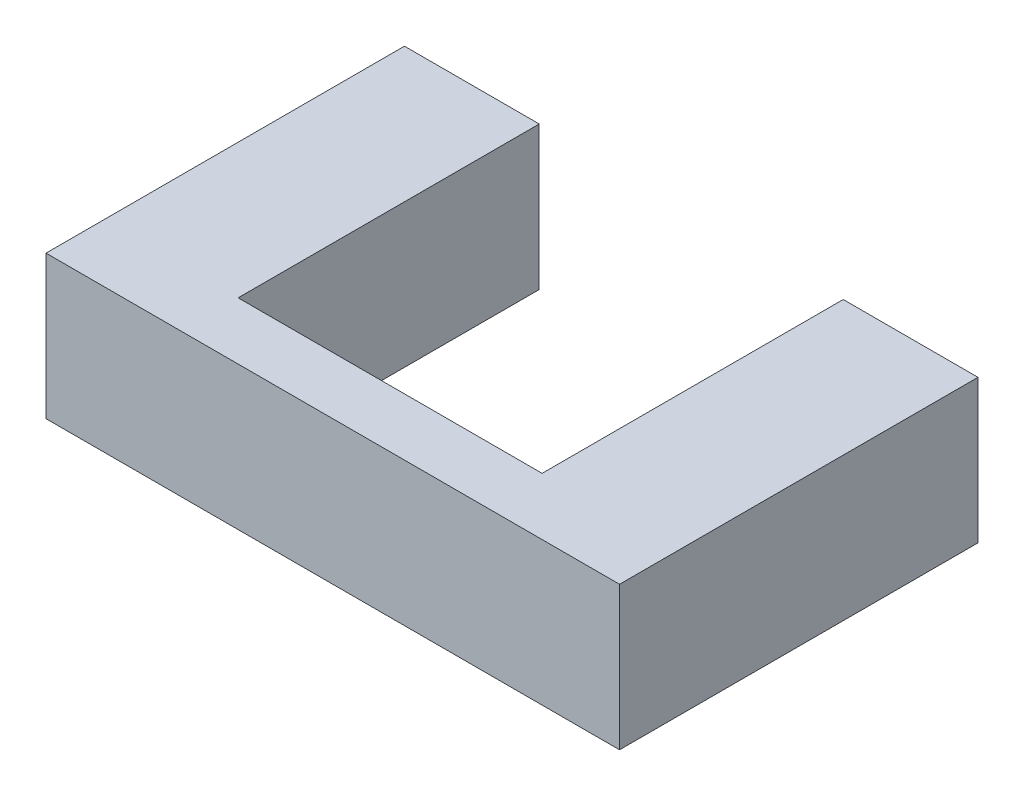
from build123d import *

# Parameters (mm, degrees)
SKETCH1_W           = 50.8
SKETCH1_H           = 31.75
BOSS_EXTRUDE1_DEPTH = 12.7
SKETCH2_W           = 26.924
SKETCH2_H           = 26.67
CUT_EXTRUDE1_DEPTH  = 12.7


with BuildPart() as part:
    # Sketch1 → Boss-Extrude1 (new body)
    with BuildSketch(Plane(origin=(0, 0, 0), x_dir=(1, 0, 0), z_dir=(0, 1, 0))):
        Rectangle(SKETCH1_W, SKETCH1_H)
    extrude(amount=BOSS_EXTRUDE1_DEPTH)

    # Sketch2 → Cut-Extrude1 (cut)
    with BuildSketch(Plane(origin=(0, 12.7, 0), x_dir=(1, 0, 0), z_dir=(0, 1, 0))):
        with Locations((0, 2.54)):
            Rectangle(SKETCH2_W, SKETCH2_H)
    extrude(amount=-CUT_EXTRUDE1_DEPTH, mode=Mode.SUBTRACT)


solid = part.part
